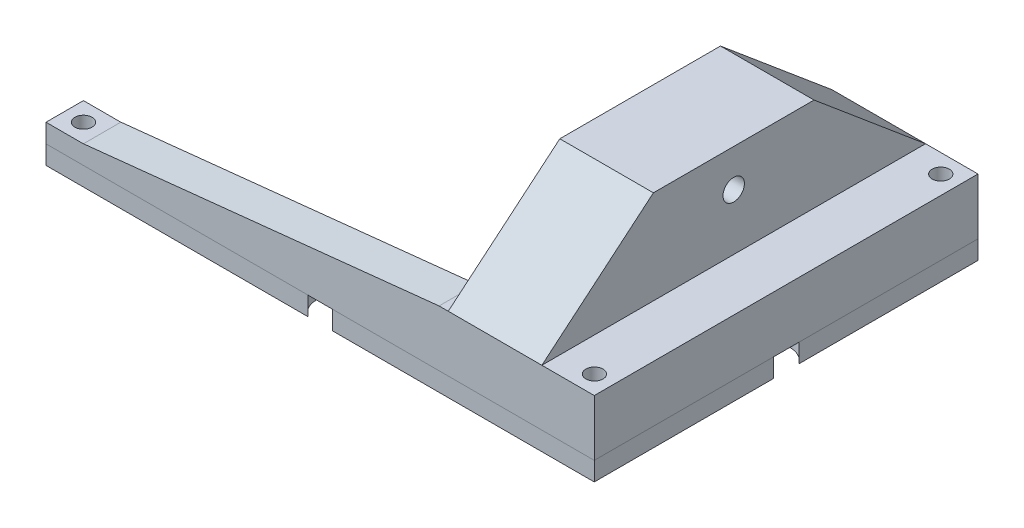
from build123d import *
from OCP.BRepFilletAPI import BRepFilletAPI_MakeChamfer

# Parameters (mm, degrees)
SKETCH_1_R               = 2.3
EXTRUDE_1_DEPTH          = 5
EXTRUDE_1_2_DEPTH        = 5
SKETCH_2_R               = 2.3
EXTRUDE_2_DEPTH          = 15
SKETCH_3_W               = 25
SKETCH_3_H               = 102.5
EXTRUDE_3_DEPTH          = 25
CUT_EXTRUDE_1_DEPTH      = 350.507632875
CUT_EXTRUDE_1_DEPTH_BACK = 350.507632875
SKETCH_4_R               = 2.86
CHAMFER_1_SIZE           = 25
CHAMFER_1_SIZE2          = 29.793839815
SKETCH_5_W               = 10
SKETCH_5_H               = 10
CUT_EXTRUDE_2_DEPTH      = 10
CHAMFER_2_SIZE           = 95
CHAMFER_2_SIZE2          = 9.98490235


with BuildPart() as part:
    # Эскиз1 → Бобышка-Вытянуть1 (new body)
    with BuildSketch(Plane(origin=(0, 246.195974268, 0), x_dir=(1, 0, 0), z_dir=(0, 1, 0))):
        with BuildLine():
            Line((68.125605484, -140.773129836), (138.010541363, -140.773129836))
            Line((138.010541363, -140.773129836), (138.010541363, -92.911646759))
            ThreePointArc((138.010541363, -92.911646759), (127.058980694, -89.523129836), (138.010541363, -86.134612913))
            Line((138.010541363, -86.134612913), (138.010541363, -38.273129836))
            Line((138.010541363, -38.273129836), (99.010541363, -38.273129836))
            Line((99.010541363, -38.273129836), (99.010541363, -130.773129836))
            Line((99.010541363, -130.773129836), (68.125605484, -130.773129836))
            ThreePointArc((68.125605484, -130.773129836), (70.808980694, -135.773129836), (68.125605484, -140.773129836))
        make_face()
        with Locations(Location((133.058980694, -135.773129836, 0), (0, 0, 180))):
            Circle(SKETCH_1_R, mode=Mode.SUBTRACT)
        with Locations(Location((133.058980694, -43.273129836, 0), (0, 0, 180))):
            Circle(SKETCH_1_R, mode=Mode.SUBTRACT)
    extrude(amount=EXTRUDE_1_DEPTH)


with BuildPart() as body_2:
    # Эскиз1 → Extrude 1 2 (new body)
    with BuildSketch(Plane(origin=(0, 246.195974268, 0), x_dir=(1, 0, 0), z_dir=(0, 1, 0))):
        with BuildLine():
            Line((-8.441019306, -140.773129836), (61.492355904, -140.773129836))
            ThreePointArc((61.492355904, -140.773129836), (58.808980694, -135.773129836), (61.492355904, -130.773129836))
            Line((61.492355904, -130.773129836), (-8.441019306, -130.773129836))
            Line((-8.441019306, -130.773129836), (-8.441019306, -140.773129836))
        make_face()
        with Locations(Location((-3.441019306, -135.773129836, 0), (0, 0, 180))):
            Circle(SKETCH_1_R, mode=Mode.SUBTRACT)
    extrude(amount=EXTRUDE_1_2_DEPTH)


with BuildPart() as body_3:
    # Эскиз2 → Бобышка-Вытянуть2 (new body)
    with BuildSketch(Plane(origin=(0, 251.195974268, 0), x_dir=(1, 0, 0), z_dir=(0, 1, 0))):
        Polygon((99.010541363, -38.273129836), (138.010541363, -38.273129836), (138.010541363, -140.773129836), (-8.441019306, -140.773129836), (-8.441019306, -130.773129836), (99.010541363, -130.773129836), align=None)
        with Locations(Location((133.058980694, -43.273129836, 0), (0, 0, 180))):
            Circle(SKETCH_2_R, mode=Mode.SUBTRACT)
        with Locations(Location((133.058980694, -135.773129836, 0), (0, 0, 180))):
            Circle(SKETCH_2_R, mode=Mode.SUBTRACT)
        with Locations(Location((-3.441019306, -135.773129836, 0), (0, 0, 180))):
            Circle(SKETCH_2_R, mode=Mode.SUBTRACT)
    extrude(amount=EXTRUDE_2_DEPTH)

    # Эскиз3 → Бобышка-Вытянуть3 (add)
    with BuildSketch(Plane(origin=(0, 266.195974268, 0), x_dir=(1, 0, 0), z_dir=(0, 1, 0))):
        with Locations((111.510541363, -89.523129836)):
            Rectangle(SKETCH_3_W, SKETCH_3_H)
    extrude(amount=EXTRUDE_3_DEPTH)

    # Эскиз4 → Вырез-Вытянуть1 (cut, two sides: drawn at the far end of the back side and taken through both)
    with BuildSketch(Plane(origin=(124.010541363, 0, 0), x_dir=(0, 0, -1), z_dir=(1, 0, 0)).offset(-CUT_EXTRUDE_1_DEPTH_BACK)):
        with Locations(Location((-89.523129836, 281.195974268, 0), (0, 0, 270))):
            Circle(SKETCH_4_R)
    extrude(amount=CUT_EXTRUDE_1_DEPTH + CUT_EXTRUDE_1_DEPTH_BACK, mode=Mode.SUBTRACT)

    # Фаска1: one chamfer whose edges measure the first distance from different faces: ONE call of the kernel's chamfer builder (chamfer() names one face for all edges)
    chamfer_1_edges_1 = [body_3.edges().sort_by_distance(p)[0] for p in [
        (111.510541363, 291.195974268, 140.773129836),
    ]]
    chamfer_1_side_1 = [body_3.faces().sort_by_distance(p)[0] for p in [
        (75.134143656, 263.125812594, 140.773129836),
    ]]
    chamfer_1_edges_2 = [body_3.edges().sort_by_distance(p)[0] for p in [
        (111.510541363, 291.195974268, 38.273129836),
    ]]
    chamfer_1_side_2 = [body_3.faces().sort_by_distance(p)[0] for p in [
        (114.894838884, 269.02655278, 38.273129836),
    ]]
    chamfer_1 = BRepFilletAPI_MakeChamfer(body_3.part.solid().wrapped)
    for e in chamfer_1_edges_1:
        chamfer_1.Add(CHAMFER_1_SIZE, CHAMFER_1_SIZE2, e.wrapped, chamfer_1_side_1[0].wrapped)  # the first distance lies on this face
    for e in chamfer_1_edges_2:
        chamfer_1.Add(CHAMFER_1_SIZE, CHAMFER_1_SIZE2, e.wrapped, chamfer_1_side_2[0].wrapped)  # the first distance lies on this face
    add(Compound.cast(chamfer_1.Shape()), mode=Mode.REPLACE)

    # Эскиз5 → Вырез-Вытянуть2 (cut)
    with BuildSketch(Plane(origin=(0, 266.195974268, 0), x_dir=(1, 0, 0), z_dir=(0, 1, 0))):
        with Locations((-3.441019306, -135.773129836)):
            Rectangle(SKETCH_5_W, SKETCH_5_H)
    extrude(amount=-CUT_EXTRUDE_2_DEPTH, mode=Mode.SUBTRACT)

    # Фаска2
    chamfer_2_edges = [body_3.edges().sort_by_distance(p)[0] for p in [
        (1.558980694, 266.195974268, 135.773129836),
    ]]
    chamfer_2_side = [body_3.faces().sort_by_distance(p)[0] for p in [
        (50.284761029, 266.195974268, 135.773129836),
    ]]
    chamfer(chamfer_2_edges, length=CHAMFER_2_SIZE, length2=CHAMFER_2_SIZE2, reference=chamfer_2_side[0])


solid = Compound([part.part, body_2.part, body_3.part])
